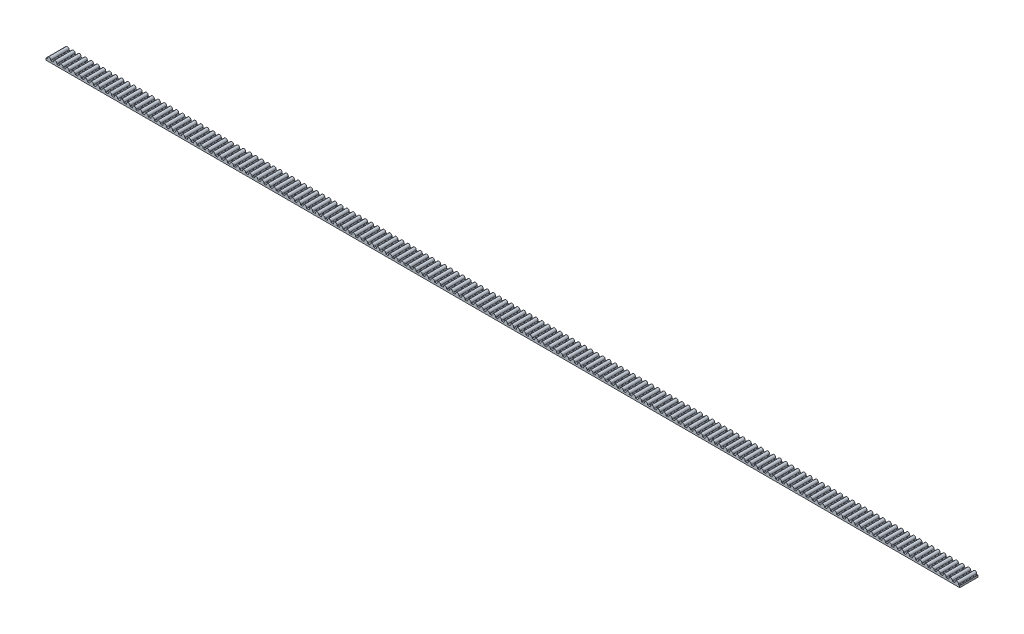
from build123d import *

# Parameters (mm, degrees)
BOSS_EXTRUDE1_DEPTH      = 3
BOSS_EXTRUDE1_DEPTH_BACK = 3
SKETCH3_W                = 300
SKETCH3_H                = 0.63
BOSS_EXTRUDE2_DEPTH      = 3
LPATTERN1_COUNT          = 150
LPATTERN1_PITCH          = 2


with BuildPart() as part:
    # Sketch3 → Boss-Extrude1 (new, two sides: drawn at the far end of the back side and taken through both)
    with BuildSketch(Plane.XY.offset(-BOSS_EXTRUDE1_DEPTH_BACK)):
        with Locations((0, -0.38)):
            Rectangle(SKETCH3_W, SKETCH3_H)
    extrude(amount=BOSS_EXTRUDE1_DEPTH + BOSS_EXTRUDE1_DEPTH_BACK)

    # Sketch4 → Boss-Extrude2 (add, symmetric)
    with BuildSketch(Plane.XY):
        with BuildLine():
            Line((-149.7058, -0.065), (-148.289325503, -0.065))
            ThreePointArc((-148.289325503, -0.065), (-148.399062705, -0.017263124), (-148.438953091, 0.09556338))
            ThreePointArc((-148.438953091, 0.09556338), (-148.997562752, 0.695), (-149.556172412, 0.09556338))
            ThreePointArc((-149.556172412, 0.09556338), (-149.596062798, -0.017263124), (-149.7058, -0.065))
        make_face()
    boss_extrude2 = extrude(amount=BOSS_EXTRUDE2_DEPTH, both=True)

    # LPattern1: Boss-Extrude2 ×150
    with Locations(*[(i * LPATTERN1_PITCH, 0, 0) for i in range(1, LPATTERN1_COUNT)]):
        add(boss_extrude2)


solid = part.part
